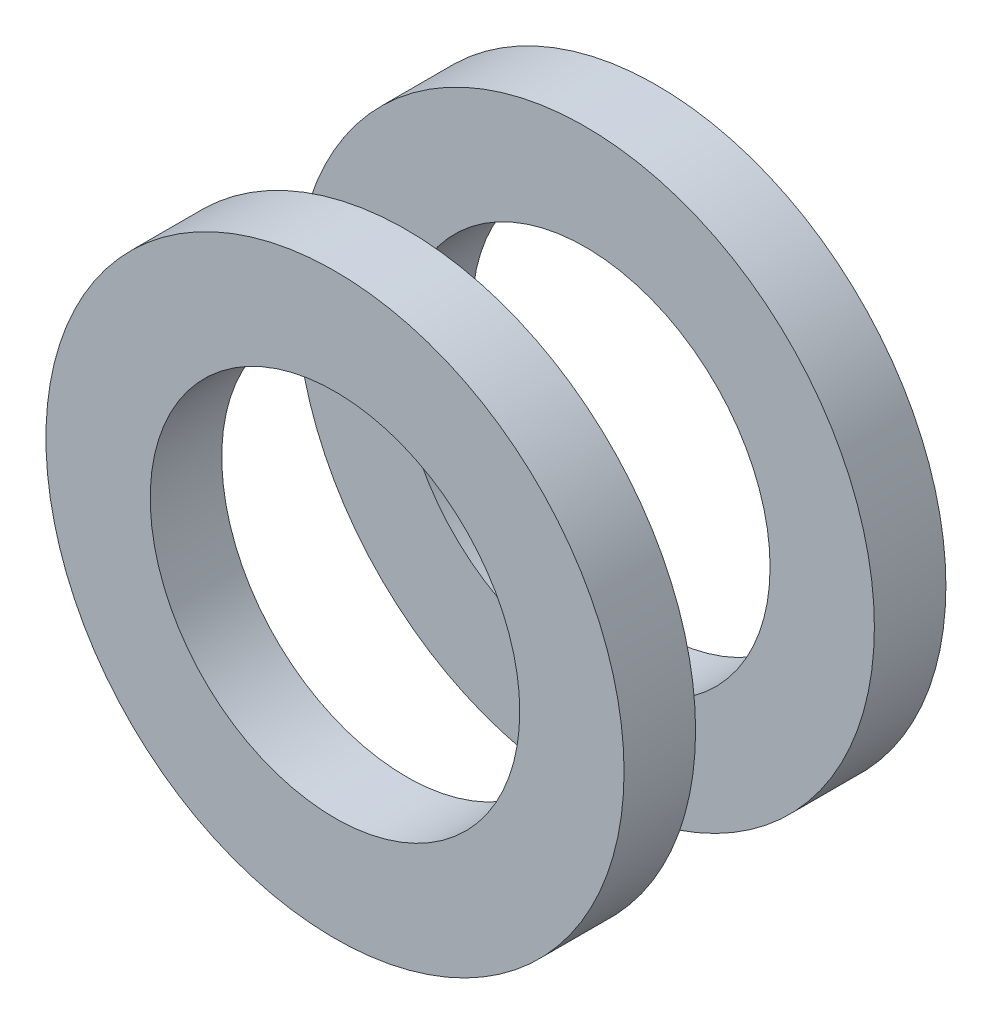
from build123d import *

# Parameters (mm, degrees)
REAR_ENDTURN_START  = -27
SKETCH_1_R          = 48.5
SKETCH_1_R_2        = 31
REAR_ENDTURN_DEPTH  = 12
FRONT_ENDTURN_START = 15
SKETCH_2_R          = 48.5
SKETCH_2_R_2        = 31
FRONT_ENDTURN_DEPTH = 12


with BuildPart() as part:
    # Эскиз1 → Rear_endturn (new body)
    with BuildSketch(Plane.XY.offset(REAR_ENDTURN_START)):
        Circle(SKETCH_1_R)
        Circle(SKETCH_1_R_2, mode=Mode.SUBTRACT)
    extrude(amount=REAR_ENDTURN_DEPTH)


with BuildPart() as body_2:
    # Эскиз2 → Front_endturn (new body)
    with BuildSketch(Plane.XY.offset(FRONT_ENDTURN_START)):
        Circle(SKETCH_2_R)
        Circle(SKETCH_2_R_2, mode=Mode.SUBTRACT)
    extrude(amount=FRONT_ENDTURN_DEPTH)


solid = Compound([part.part, body_2.part])
